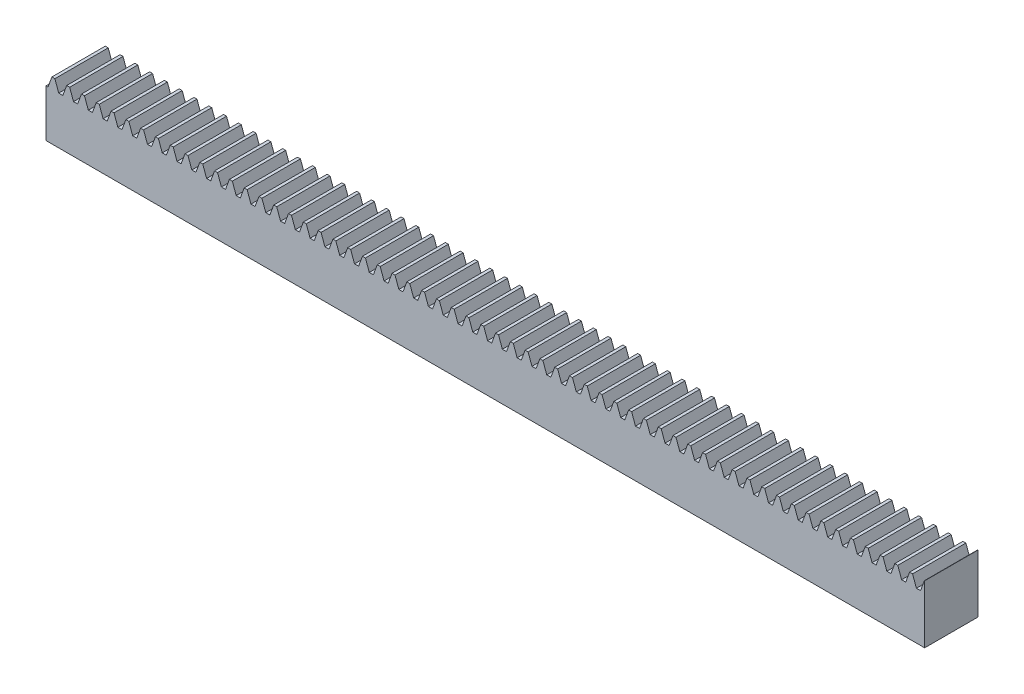
from build123d import *

# Parameters (mm, degrees)
BLANKSKE_W        = 280
BLANKSKE_H        = 18.5
BLANK_DEPTH       = 17
TOOTHCUTSIM_DEPTH = 282.12497221
TEETHCUTS_COUNT   = 60
TEETHCUTS_PITCH   = 4.712388975


with BuildPart() as part:
    # BlankSke → Blank (new body)
    with BuildSketch(Plane.XY):
        with Locations((140, 9.25)):
            Rectangle(BLANKSKE_W, BLANKSKE_H)
    extrude(amount=-BLANK_DEPTH)

    # TooCutSkeSim → ToothCutSim (cut, through all)
    with BuildSketch(Plane.XY):
        Polygon((0.654653055, 15.125), (-0.654653055, 15.125), (-1.892297439, 18.5254), (1.892297439, 18.5254), align=None)
    toothcutsim = extrude(amount=-TOOTHCUTSIM_DEPTH, mode=Mode.SUBTRACT)

    # TeethCuts: ToothCutSim ×60
    with Locations(*[(i * TEETHCUTS_PITCH, 0, 0) for i in range(1, TEETHCUTS_COUNT)]):
        add(toothcutsim, mode=Mode.SUBTRACT)


solid = part.part
